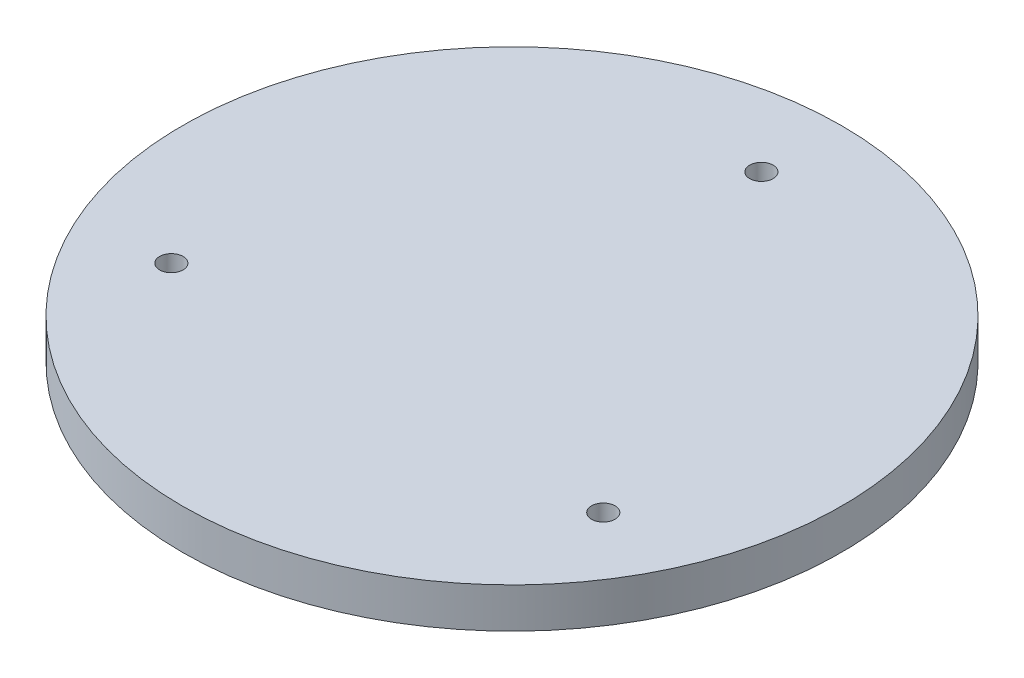
from build123d import *

# Parameters (mm, degrees)
SKETCH1_R           = 117.475
BOSS_EXTRUDE1_DEPTH = 14.2875
SKETCH2_R           = 4.1783
CUT_EXTRUDE1_DEPTH  = 167.747965224


with BuildPart() as part:
    # Sketch1 → Boss-Extrude1 (new body)
    with BuildSketch(Plane(origin=(0, 0, 0), x_dir=(1, 0, 0), z_dir=(0, 1, 0))):
        with Locations(Location((0, 0, 0), (0, 0, 270))):
            Circle(SKETCH1_R)
    extrude(amount=BOSS_EXTRUDE1_DEPTH)

    # Sketch2 → Cut-Extrude1 (cut, through all)
    with BuildSketch(Plane(origin=(0, 14.2875, 0), x_dir=(1, 0, 0), z_dir=(0, 1, 0))):
        with Locations(Location((0, 88.9, 0), (0, 0, 270))):
            Circle(SKETCH2_R)
        with Locations(Location((76.989658396, -44.45, 0), (0, 0, 270))):
            Circle(SKETCH2_R)
        with Locations(Location((-76.989658396, -44.45, 0), (0, 0, 270))):
            Circle(SKETCH2_R)
    extrude(amount=-CUT_EXTRUDE1_DEPTH, mode=Mode.SUBTRACT)


solid = part.part
